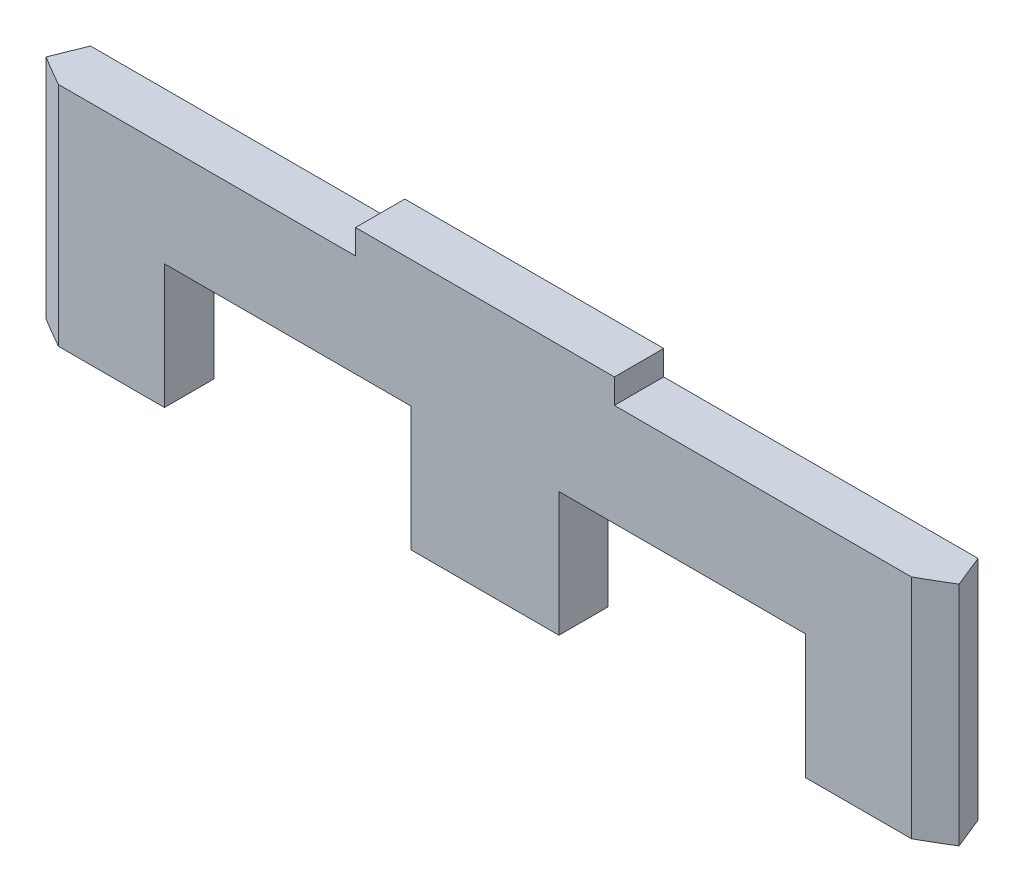
from build123d import *

# Parameters (mm, degrees)
BOSS_EXTRUDE1_DEPTH = 2
BOSS_EXTRUDE2_DEPTH = 9.2
CUT_EXTRUDE1_REACH  = 23.032


with BuildPart() as part:
    # Sketch1 → Boss-Extrude1 (new body)
    with BuildSketch(Plane.XY):
        Polygon((3, -2.075), (13, -2.075), (13, -7.125), (18, -7.125), (18, -2.075), (18, 2.075), (5.25, 2.075), (5.25, 3.075), (-5.25, 3.075), (-5.25, 2.075), (-18, 2.075), (-18, -2.075), (-18, -7.125), (-13, -7.125), (-13, -2.075), (-3, -2.075), (-3, -7.125), (3, -7.125), align=None)
    extrude(amount=BOSS_EXTRUDE1_DEPTH)

    # Sketch2 → Boss-Extrude2 (add)
    with BuildSketch(Plane(origin=(0, 2.075, 0), x_dir=(1, 0, 0), z_dir=(0, 1, 0))):
        Polygon((-18, 0), (-18.806783424, -2), (-18, -2), align=None)
        Polygon((18, 0), (18, -2), (18.806783424, -2), align=None)
    extrude(amount=-BOSS_EXTRUDE2_DEPTH)

    # Sketch3 → Cut-Extrude1 (cut, up to next)
    with BuildSketch(Plane(origin=(0, 2.075, 0), x_dir=(1, 0, 0), z_dir=(0, 1, 0)), mode=Mode.PRIVATE) as cut_extrude1_sk1:
        with BuildLine():
            Line((-18.519101852, -1.286843127), (-18.806783424, -2))
            Line((-18.806783424, -2), (-17.298843892, -2))
            ThreePointArc((-17.298843892, -2), (-17.912522366, -1.649494979), (-18.519101852, -1.286843127))
        make_face()
    cut_extrude1_tool1 = extrude(cut_extrude1_sk1.sketch, amount=-CUT_EXTRUDE1_REACH, mode=Mode.PRIVATE) & part.part
    # Sketch3 → Cut-Extrude1 (cut, up to next)
    with BuildSketch(Plane(origin=(0, 2.075, 0), x_dir=(1, 0, 0), z_dir=(0, 1, 0)), mode=Mode.PRIVATE) as cut_extrude1_sk2:
        with BuildLine():
            Line((18.806783424, -2), (17.298843892, -2))
            ThreePointArc((17.298843892, -2), (17.912522366, -1.649494979), (18.519101852, -1.286843127))
            Line((18.519101852, -1.286843127), (18.806783424, -2))
        make_face()
    cut_extrude1_tool2 = extrude(cut_extrude1_sk2.sketch, amount=-CUT_EXTRUDE1_REACH, mode=Mode.PRIVATE) & part.part
    add(cut_extrude1_tool1.solids().sort_by_distance((-18.211961, 2.075, 1.763734))[0], mode=Mode.SUBTRACT)
    add(cut_extrude1_tool2.solids().sort_by_distance((18.211961, 2.075, 1.763734))[0], mode=Mode.SUBTRACT)


solid = part.part
